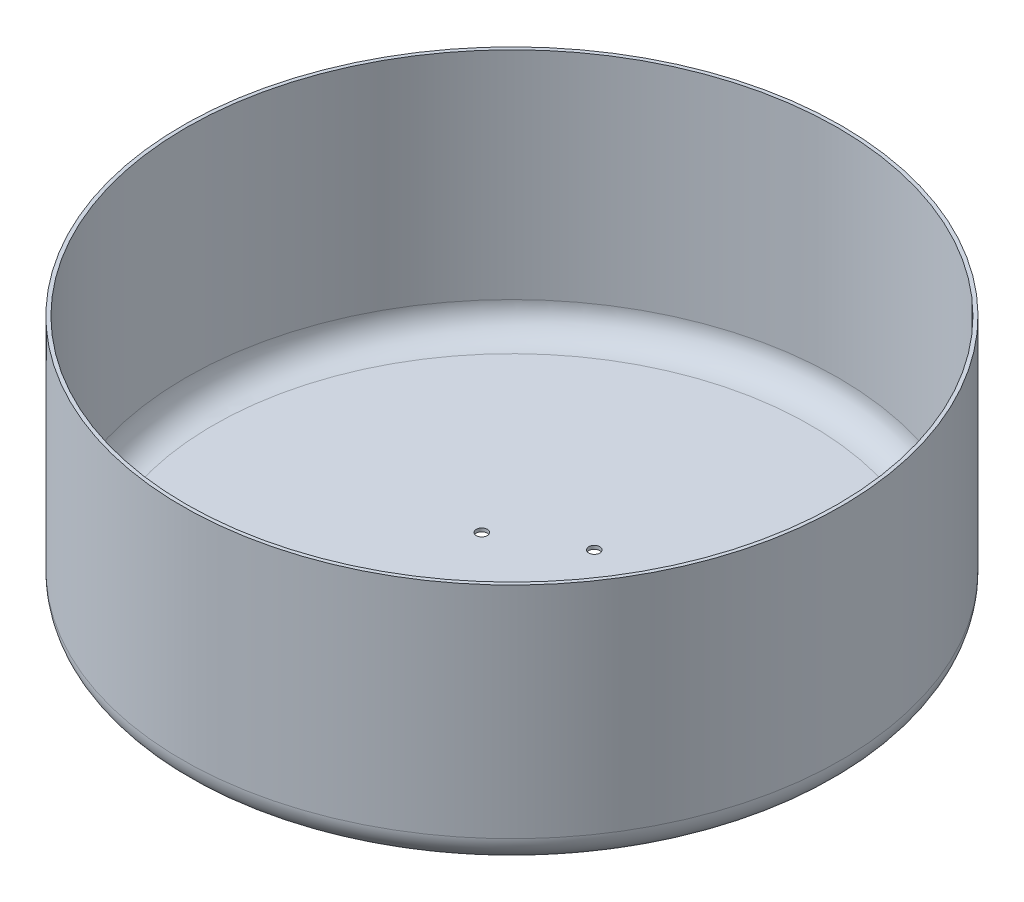
from build123d import *

# Parameters (mm, degrees)
FILLET1_R              = 12.7
F_10_CLEARANCE_HOLE1_D = 5.1054


with BuildPart() as part:
    # Sketch1 → Revolve1 (revolve)
    with BuildSketch(Plane.XY, mode=Mode.PRIVATE) as revolve1_sk:
        Polygon((0, 0), (152.4, 0), (152.4, 114.3), (150.749, 114.3), (150.749, 1.5748), (0, 1.5748), align=None)
    revolve(revolve1_sk.sketch.rotate(Axis((0, 0, 0), (0, 1, 0)), 90), axis=Axis((0, 0, 0), (0, 1, 0)))

    # Fillet1
    fillet1_edges = [part.edges().sort_by_distance(p)[0] for p in [
        (0, 1.5748, 150.749),
        (0, 0, 152.4),
    ]]
    fillet(fillet1_edges, radius=FILLET1_R)

    # #10 Clearance Hole1 (through all)
    with Locations(Plane.XZ):
        with Locations((0, 38.1), (32.995567884, 19.05), (32.995567884, -19.05), (0, -38.1), (-32.995567884, -19.05), (-32.995567884, 19.05)):
            Hole(F_10_CLEARANCE_HOLE1_D / 2)


solid = part.part
